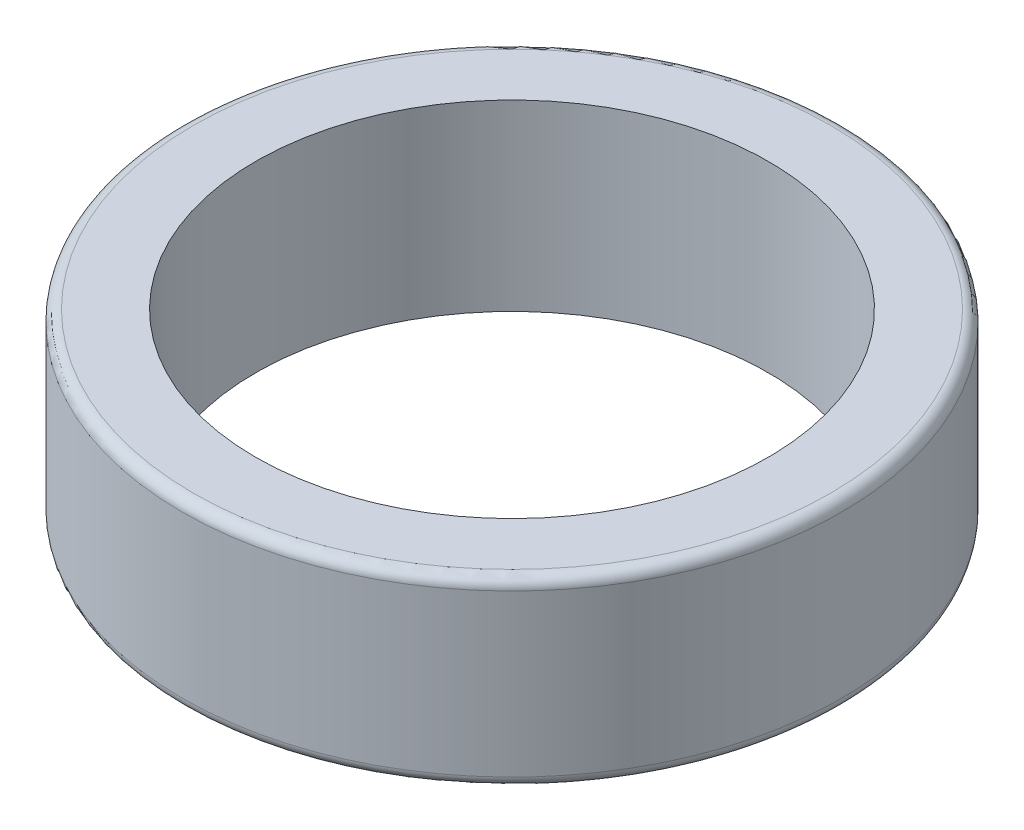
from build123d import *

# Parameters (mm, degrees)
BOSS_EXTRUDE1_DEPTH      = 25
BOSS_EXTRUDE1_DEPTH_BACK = 25
SKETCH1_R                = 90
SKETCH1_R_2              = 70
FILLET1_R                = 3


with BuildPart() as part:
    # Sketch1 → Boss-Extrude1 (new, two sides: drawn at the far end of the back side and taken through both)
    with BuildSketch(Plane(origin=(0, 0, 0), x_dir=(1, 0, 0), z_dir=(0, 1, 0)).offset(-BOSS_EXTRUDE1_DEPTH_BACK)):
        Circle(SKETCH1_R)
        Circle(SKETCH1_R_2, mode=Mode.SUBTRACT)
    extrude(amount=BOSS_EXTRUDE1_DEPTH + BOSS_EXTRUDE1_DEPTH_BACK)

    # Fillet1
    fillet1_edges = [part.edges().sort_by_distance(p)[0] for p in [
        (-90, 25, 0),
        (-90, -25, 0),
    ]]
    fillet(fillet1_edges, radius=FILLET1_R)


solid = part.part
